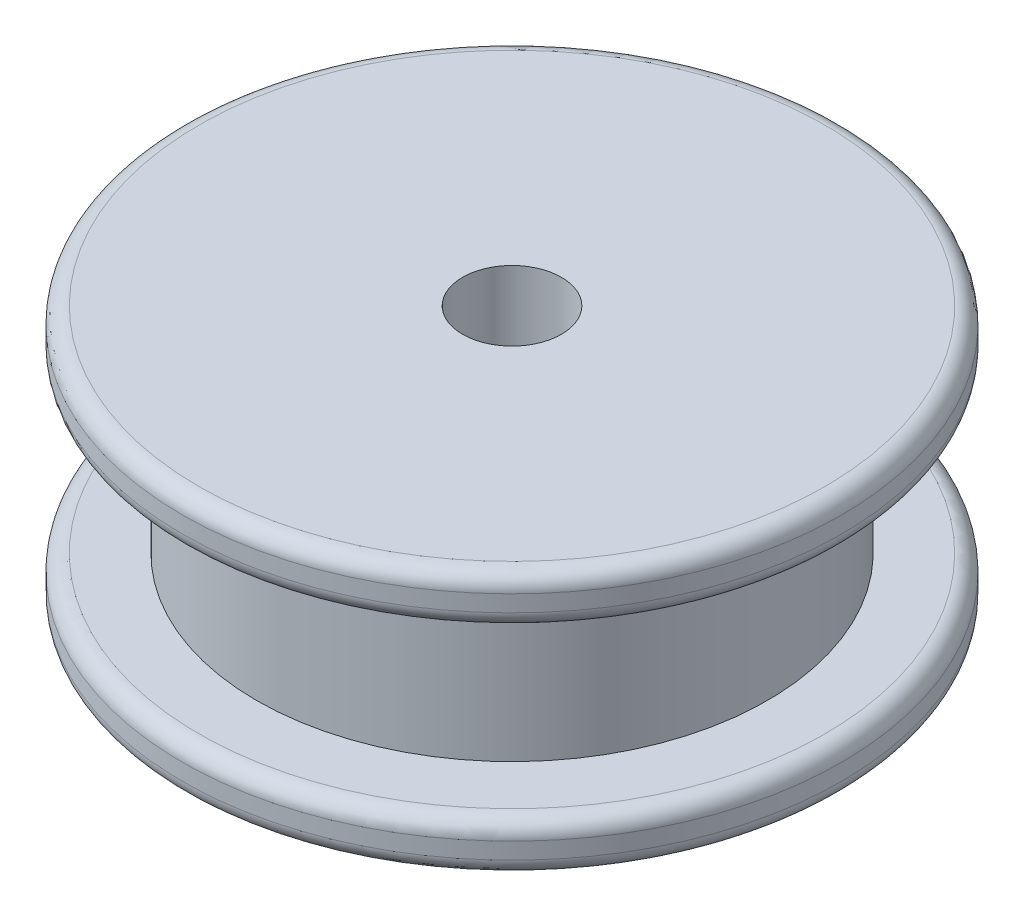
from build123d import *

# Parameters (mm, degrees)
SKETCH_1_R          = 15.5
EXTRUDE_1_DEPTH     = 10
SKETCH_2_R          = 20
EXTRUDE_2_DEPTH     = 3
EXTRUDE_START       = 3
SKETCH_3_R          = 20
EXTRUDE_3_DEPTH     = 3
FILLET_2_R          = 1
SKETCH_4_R          = 3
CUT_EXTRUDE_1_DEPTH = 33.49615368


with BuildPart() as part:
    # 草图1 → 凸台-拉伸1 (new body)
    with BuildSketch(Plane(origin=(0, 0, 0), x_dir=(1, 0, 0), z_dir=(0, 1, 0))):
        with Locations(Location((0, 0, 0), (0, 0, 270))):
            Circle(SKETCH_1_R)
    extrude(amount=EXTRUDE_1_DEPTH)

    # 草图2 → 凸台-拉伸2 (add)
    with BuildSketch(Plane(origin=(0, 10, 0), x_dir=(1, 0, 0), z_dir=(0, 1, 0))):
        with Locations(Location((0, 0, 0), (0, 0, 270))):
            Circle(SKETCH_2_R)
    extrude(amount=EXTRUDE_2_DEPTH)

    # 草图3 → 凸台-拉伸3 (add)
    with BuildSketch(Plane.XZ.offset(EXTRUDE_START)):
        with Locations(Location((0, 0, 0), (0, 0, 90))):
            Circle(SKETCH_3_R)
    extrude(amount=-EXTRUDE_3_DEPTH)

    # 圆角2
    fillet_2_edges = [part.edges().sort_by_distance(p)[0] for p in [
        (0, -3, -20),
        (0, 10, -20),
        (0, 13, -20),
        (0, 0, -20),
    ]]
    fillet(fillet_2_edges, radius=FILLET_2_R)

    # 草图4 → 切除-拉伸1 (cut, through all)
    with BuildSketch(Plane(origin=(0, 13, 0), x_dir=(1, 0, 0), z_dir=(0, 1, 0))):
        with Locations(Location((0, 0, 0), (0, 0, 270))):
            Circle(SKETCH_4_R)
    extrude(amount=-CUT_EXTRUDE_1_DEPTH, mode=Mode.SUBTRACT)


solid = part.part
